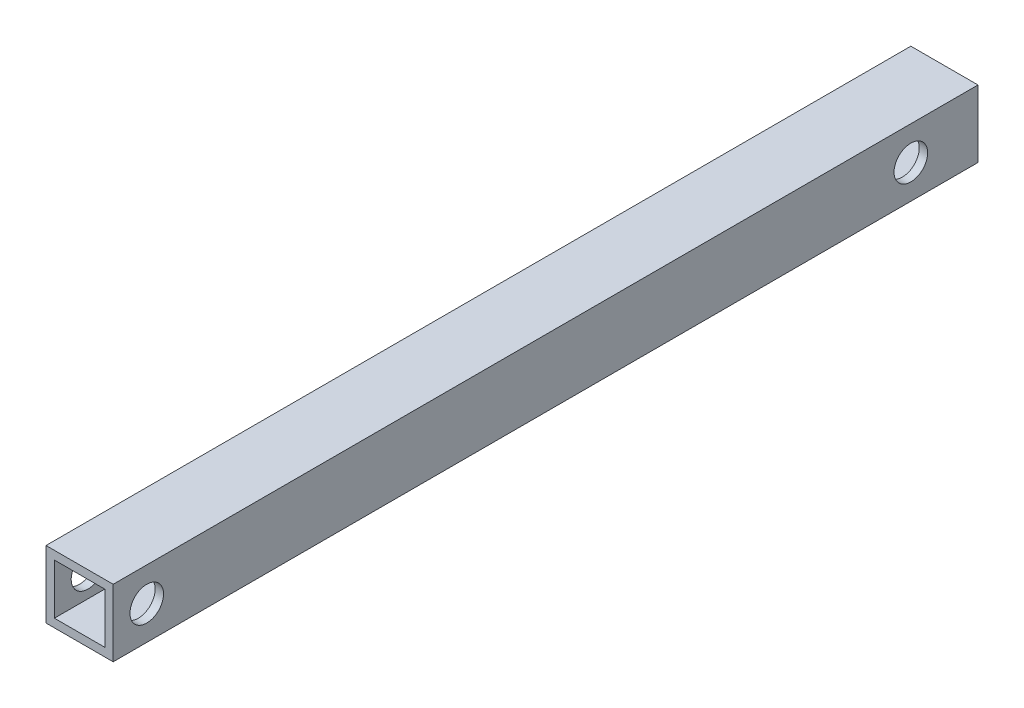
from build123d import *

# Parameters (mm, degrees)
SKETCH1_W           = 25.4
SKETCH1_H           = 25.4
SKETCH1_W_2         = 19.05
SKETCH1_H_2         = 19.05
BOSS_EXTRUDE1_DEPTH = 327.025
SKETCH5_R           = 6.35
CUT_EXTRUDE4_DEPTH  = 329.991900546


with BuildPart() as part:
    # Sketch1 → Boss-Extrude1 (new body)
    with BuildSketch(Plane.XY):
        with Locations((-12.7, 12.7)):
            Rectangle(SKETCH1_W, SKETCH1_H)
        with Locations((-12.7, 12.7)):
            Rectangle(SKETCH1_W_2, SKETCH1_H_2, mode=Mode.SUBTRACT)
    extrude(amount=BOSS_EXTRUDE1_DEPTH)

    # Sketch5 → Cut-Extrude4 (cut, through all)
    with BuildSketch(Plane(origin=(0, 0, 0), x_dir=(0, 0, -1), z_dir=(1, 0, 0))):
        with Locations(Location((-25.4, 12.7, 0), (0, 0, 90))):
            Circle(SKETCH5_R)
        with Locations(Location((-314.325, 12.7, 0), (0, 0, 90))):
            Circle(SKETCH5_R)
    extrude(amount=-CUT_EXTRUDE4_DEPTH, mode=Mode.SUBTRACT)


solid = part.part
